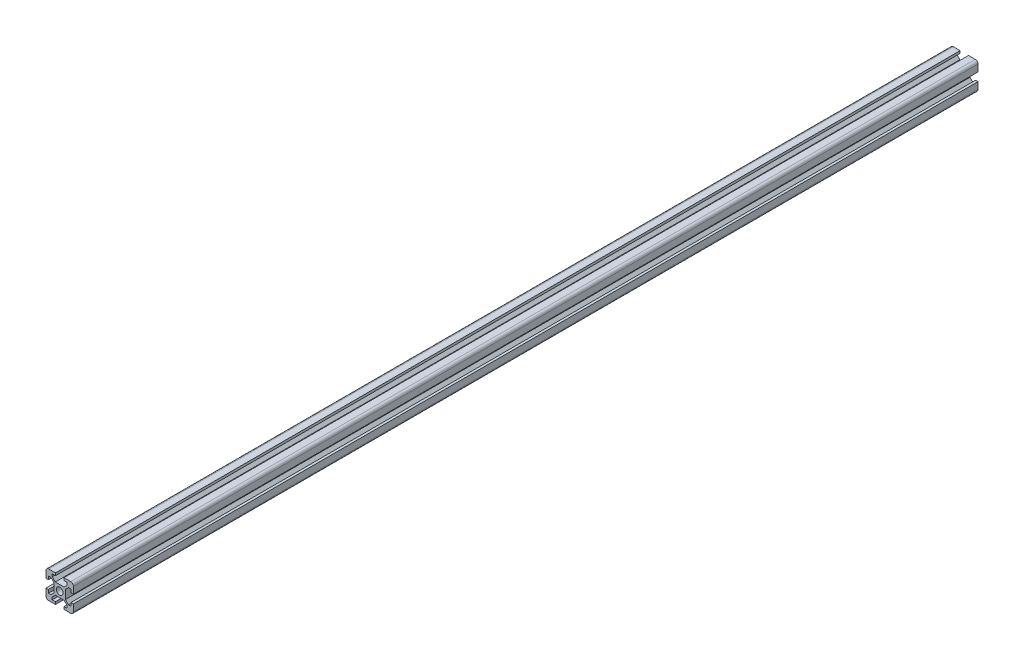
from build123d import *

# Parameters (mm, degrees)
SKETCH1_R           = 2.5
BOSS_EXTRUDE1_DEPTH = 660
FILLET1_R           = 2


with BuildPart() as part:
    # Sketch1 → Boss-Extrude1 (new body)
    with BuildSketch(Plane.XY):
        Polygon((-5.46, -6.42), (-3.215, -4.175), (3.215, -4.175), (5.46, -6.42), (5.46, -8.22), (3.06, -8.22), (3.06, -10), (10, -10), (10, -3.06), (8.22, -3.06), (8.22, -5.46), (6.42, -5.46), (4.175, -3.215), (4.175, 3.215), (6.42, 5.46), (8.22, 5.46), (8.22, 3.06), (10, 3.06), (10, 10), (3.06, 10), (3.06, 8.22), (5.46, 8.22), (5.46, 6.42), (3.215, 4.175), (-3.215, 4.175), (-5.46, 6.42), (-5.46, 8.22), (-3.06, 8.22), (-3.06, 10), (-10, 10), (-10, 3.06), (-8.22, 3.06), (-8.22, 5.46), (-6.42, 5.46), (-4.175, 3.215), (-4.175, -3.215), (-6.42, -5.46), (-8.22, -5.46), (-8.22, -3.06), (-10, -3.06), (-10, -10), (-3.06, -10), (-3.06, -8.22), (-5.46, -8.22), align=None)
        Circle(SKETCH1_R, mode=Mode.SUBTRACT)
    extrude(amount=BOSS_EXTRUDE1_DEPTH)

    # Fillet1
    fillet1_edges = [part.edges().sort_by_distance(p)[0] for p in [
        (10, -10, 330),
        (-10, -10, 330),
        (-10, 10, 330),
        (10, 10, 330),
    ]]
    fillet(fillet1_edges, radius=FILLET1_R)


solid = part.part
